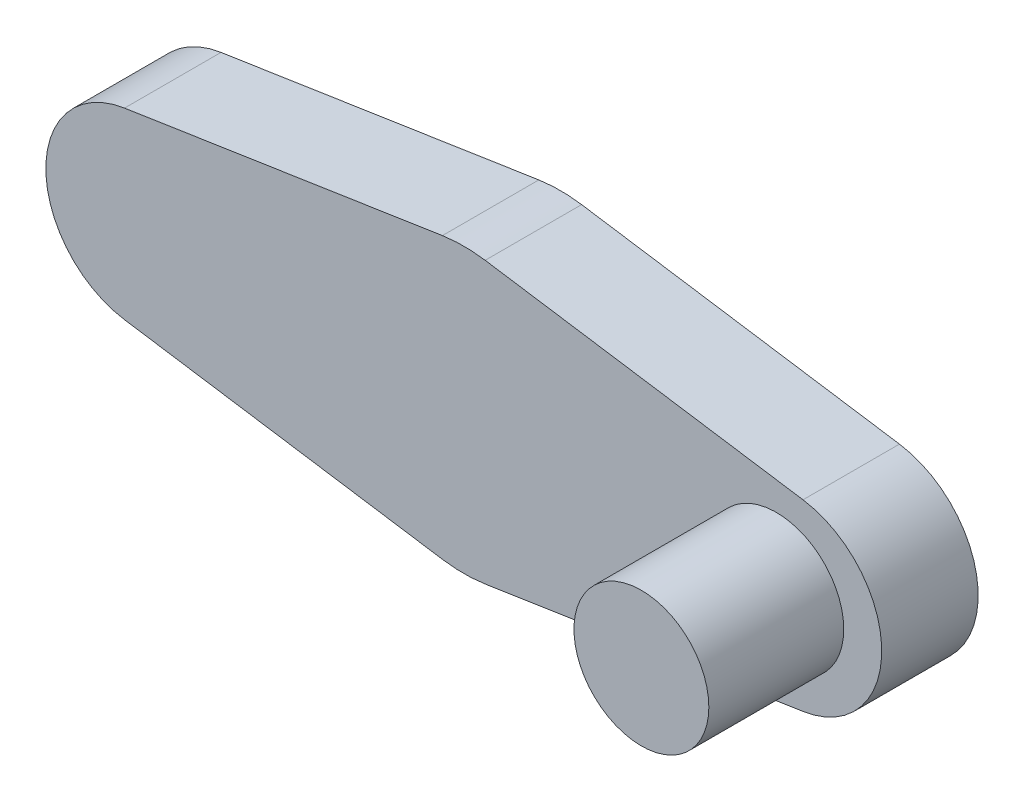
from build123d import *

# Parameters (mm, degrees)
BOSS_EXTRUDE1_DEPTH = 2
BOSS_EXTRUDE2_DEPTH = 2.54
SKETCH3_R           = 3.175
BOSS_EXTRUDE3_DEPTH = 6.35


with BuildPart() as part:
    # Sketch1 → Boss-Extrude1 (new body)
    with BuildSketch(Plane.XY):
        with BuildLine():
            Line((6.058373601, -6.598394326), (21.020213328, -4.31191015))
            ThreePointArc((21.020213328, -4.31191015), (24.724999848, 0.002643865), (21.019053909, 4.316202049))
            Line((21.019053909, 4.316202049), (6.056600222, 6.598665092))
            ThreePointArc((6.056600222, 6.598665092), (5.05, 6.675), (4.043399778, 6.598665092))
            Line((4.043399778, 6.598665092), (-10.919053909, 4.316202049))
            ThreePointArc((-10.919053909, 4.316202049), (-14.624999848, 0.002643865), (-10.920213328, -4.31191015))
            Line((-10.920213328, -4.31191015), (4.041626399, -6.598394326))
            ThreePointArc((4.041626399, -6.598394326), (5.05, -6.675), (6.058373601, -6.598394326))
        make_face()
        with BuildLine():
            Line((20.63601802, 1.80524934), (5.673564332, 4.087712383))
            ThreePointArc((5.673564332, 4.087712383), (5.05, 4.135), (4.426435668, 4.087712383))
            Line((4.426435668, 4.087712383), (-10.53601802, 1.80524934))
            ThreePointArc((-10.53601802, 1.80524934), (-12.084999871, 0.002302548), (-10.536502624, -1.801060474))
            Line((-10.536502624, -1.801060474), (4.425337102, -4.08754465))
            ThreePointArc((4.425337102, -4.08754465), (5.05, -4.135), (5.674662898, -4.08754465))
            Line((5.674662898, -4.08754465), (20.636502624, -1.801060474))
            ThreePointArc((20.636502624, -1.801060474), (22.184999871, 0.002302548), (20.63601802, 1.80524934))
        make_face(mode=Mode.SUBTRACT)
    extrude(amount=BOSS_EXTRUDE1_DEPTH)

    # Sketch2 → Boss-Extrude2 (add)
    with BuildSketch(Plane.XY.offset(2)):
        with BuildLine():
            Line((6.058373601, -6.598394326), (21.020213328, -4.31191015))
            ThreePointArc((21.020213328, -4.31191015), (24.724999848, 0.002643865), (21.019053909, 4.316202049))
            Line((21.019053909, 4.316202049), (6.056600222, 6.598665092))
            ThreePointArc((6.056600222, 6.598665092), (5.05, 6.675), (4.043399778, 6.598665092))
            Line((4.043399778, 6.598665092), (-10.919053909, 4.316202049))
            ThreePointArc((-10.919053909, 4.316202049), (-14.624999848, 0.002643865), (-10.920213328, -4.31191015))
            Line((-10.920213328, -4.31191015), (4.041626399, -6.598394326))
            ThreePointArc((4.041626399, -6.598394326), (5.05, -6.675), (6.058373601, -6.598394326))
        make_face()
    extrude(amount=BOSS_EXTRUDE2_DEPTH)

    # Sketch3 → Boss-Extrude3 (add)
    with BuildSketch(Plane.XY.offset(4.54)):
        with Locations((19.761311468, 0)):
            Circle(SKETCH3_R)
    extrude(amount=BOSS_EXTRUDE3_DEPTH)


solid = part.part
